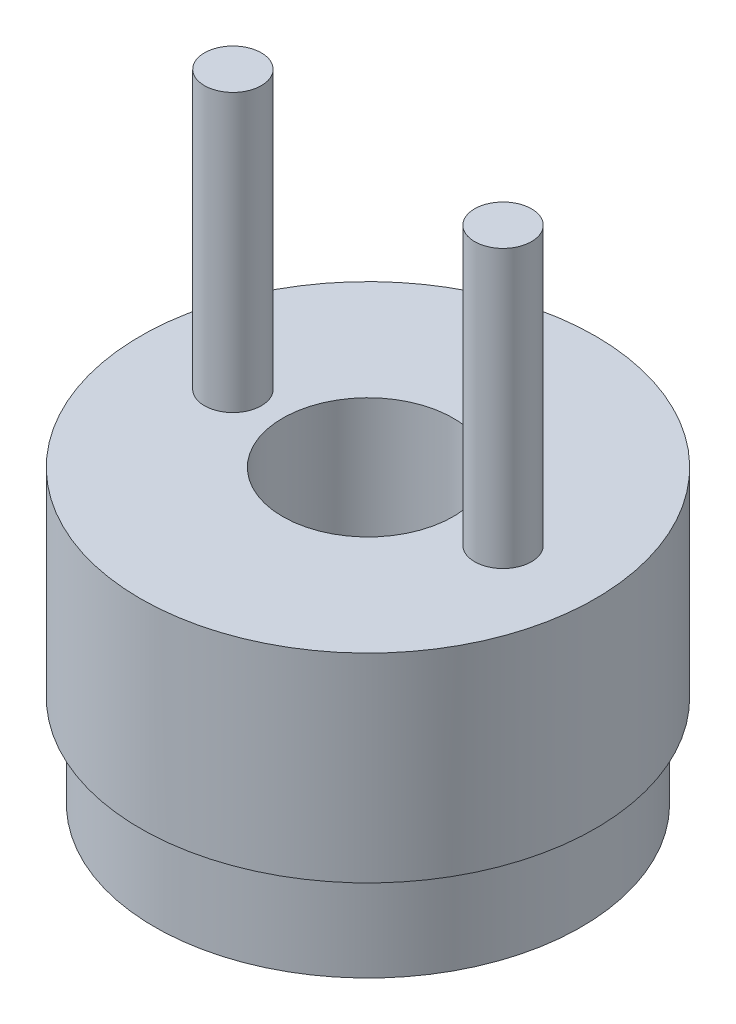
from build123d import *

# Parameters (mm, degrees)
SKETCH1_R             = 16
BOSS_EXTRUDE1_DEPTH   = 40
SKETCH2_R             = 6
CUT_EXTRUDE1_DEPTH    = 46.956501172
SKETCH4_R             = 20
SKETCH4_R_2           = 15
CUT_EXTRUDE2_DEPTH    = 26
SKETCH5_R             = 15
CUT_EXTRUDE3_DEPTH    = 19.5
SKETCH3_R             = 2
BOSS_EXTRUDE2_DEPTH   = 40
BOSS_EXTRUDE2_2_DEPTH = 40
SKETCH7_R             = 2
CUT_EXTRUDE5_DEPTH    = 64.657285522


with BuildPart() as part:
    # Sketch1 → Boss-Extrude1 (new body)
    with BuildSketch(Plane(origin=(0, 0, 0), x_dir=(1, 0, 0), z_dir=(0, 1, 0))):
        with Locations(Location((0, 0, 0), (0, 0, 270))):
            Circle(SKETCH1_R)
    extrude(amount=BOSS_EXTRUDE1_DEPTH)

    # Sketch2 → Cut-Extrude1 (cut, through all)
    with BuildSketch(Plane(origin=(0, 40, 0), x_dir=(1, 0, 0), z_dir=(0, 1, 0))):
        with Locations(Location((0, 0, 0), (0, 0, 270))):
            Circle(SKETCH2_R)
    extrude(amount=-CUT_EXTRUDE1_DEPTH, mode=Mode.SUBTRACT)

    # Sketch4 → Cut-Extrude2 (cut)
    with BuildSketch(Plane(origin=(0, 0, 0), x_dir=(-1, 0, 0), z_dir=(0, -1, 0))):
        Circle(SKETCH4_R)
        with Locations(Location((0, 0, 0), (0, 0, 90))):
            Circle(SKETCH4_R_2, mode=Mode.SUBTRACT)
    extrude(amount=-CUT_EXTRUDE2_DEPTH, mode=Mode.SUBTRACT)

    # Sketch5 → Cut-Extrude3 (cut)
    with BuildSketch(Plane.XZ):
        with Locations(Location((0, 0, 0), (0, 0, 270))):
            Circle(SKETCH5_R)
    extrude(amount=-CUT_EXTRUDE3_DEPTH, mode=Mode.SUBTRACT)

    # Sketch7 → Cut-Extrude5 (cut, through all)
    with BuildSketch(Plane(origin=(0, 0, 0), x_dir=(-1, 0, 0), z_dir=(0, -1, 0))):
        with Locations(Location((9.5, 0, 0), (0, 0, 270))):
            Circle(SKETCH7_R)
        with Locations(Location((-9.5, 0, 0), (0, 0, 90))):
            Circle(SKETCH7_R)
    extrude(amount=-CUT_EXTRUDE5_DEPTH, mode=Mode.SUBTRACT)


with BuildPart() as body_2:
    # Sketch3 → Boss-Extrude2 (new body)
    with BuildSketch(Plane(origin=(0, 19.5, 0), x_dir=(1, 0, 0), z_dir=(0, 1, 0))):
        with Locations(Location((-9.5, 0, 0), (0, 0, 270))):
            Circle(SKETCH3_R)
    extrude(amount=BOSS_EXTRUDE2_DEPTH)


with BuildPart() as body_3:
    # Sketch3 → Boss-Extrude2 2 (new body)
    with BuildSketch(Plane(origin=(0, 19.5, 0), x_dir=(1, 0, 0), z_dir=(0, 1, 0))):
        with Locations(Location((9.5, 0, 0), (0, 0, 90))):
            Circle(SKETCH3_R)
    extrude(amount=BOSS_EXTRUDE2_2_DEPTH)


solid = Compound([part.part, body_2.part, body_3.part])
